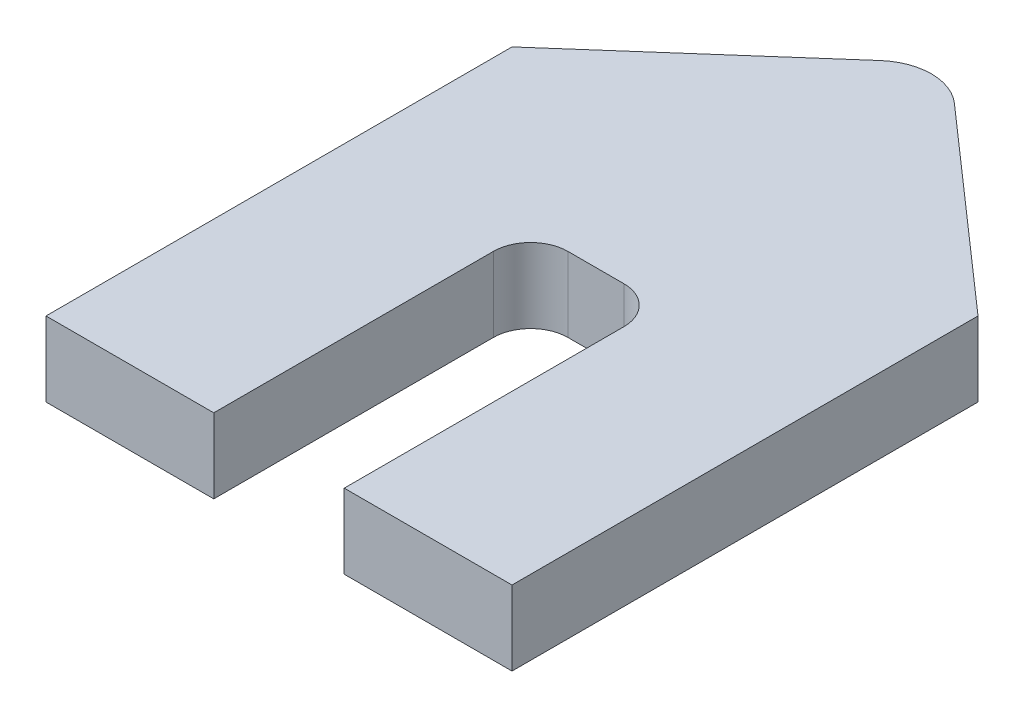
from build123d import *

# Parameters (mm, degrees)
BOSS_EXTRUDE1_DEPTH = 2
CUT_EXTRUDE1_REACH  = 28.048
SKETCH2_W           = 7
SKETCH2_H           = 17
FILLET1_R           = 2


with BuildPart() as part:
    # Sketch1 → Boss-Extrude1 (new, symmetric)
    with BuildSketch(Plane(origin=(0, 0, 0), x_dir=(1, 0, 0), z_dir=(0, 1, 0))):
        with BuildLine():
            Line((-12.5, -12.5), (12.5, -12.5))
            Line((12.5, -12.5), (12.5, 12.5))
            Line((12.5, 12.5), (1.9814248, 21.752544286))
            ThreePointArc((1.9814248, 21.752544286), (0, 22.5), (-1.9814248, 21.752544286))
            Line((-1.9814248, 21.752544286), (-12.5, 12.5))
            Line((-12.5, 12.5), (-12.5, -12.5))
        make_face()
    extrude(amount=BOSS_EXTRUDE1_DEPTH, both=True)

    # Sketch2 → Cut-Extrude1 (cut, up to next)
    with BuildSketch(Plane(origin=(0, 2, 0), x_dir=(1, 0, 0), z_dir=(0, 1, 0)), mode=Mode.PRIVATE) as cut_extrude1_sk1:
        with Locations((0, -4)):
            Rectangle(SKETCH2_W, SKETCH2_H)
    cut_extrude1_tool1 = extrude(cut_extrude1_sk1.sketch, amount=-CUT_EXTRUDE1_REACH, mode=Mode.PRIVATE) & part.part
    add(cut_extrude1_tool1.solids().sort_by_distance((0, 2, 4))[0], mode=Mode.SUBTRACT)

    # Fillet1
    fillet1_edges = [part.edges().sort_by_distance(p)[0] for p in [
        (-3.5, 0, -4.5),
        (3.5, 0, -4.5),
    ]]
    fillet(fillet1_edges, radius=FILLET1_R)


solid = part.part
